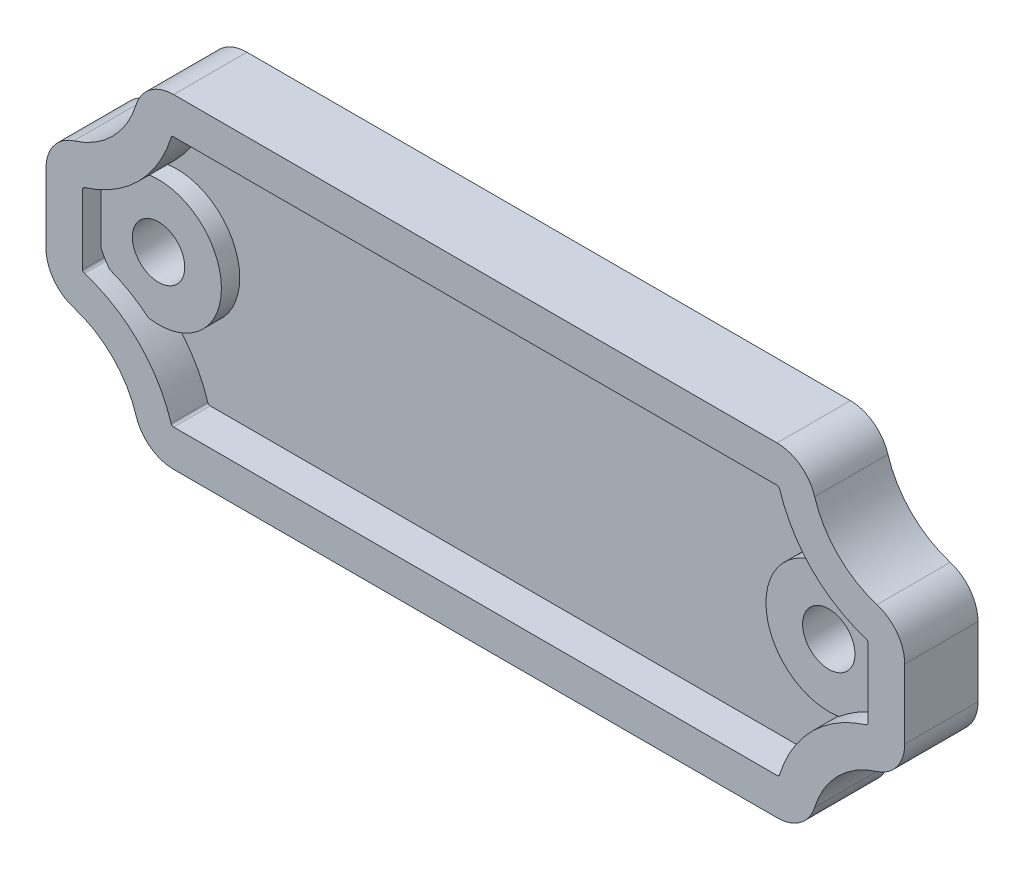
from build123d import *

# Parameters (mm, degrees)
SKETCH1_R           = 2.5
BOSS_EXTRUDE1_DEPTH = 7
FILLET1_R           = 3.75
CUT_EXTRUDE1_DEPTH  = 3.5
BOSS_EXTRUDE2_START = -5.25
SKETCH4_R           = 6
SKETCH4_R_2         = 2.5
BOSS_EXTRUDE2_DEPTH = 7


with BuildPart() as part:
    # Sketch1 → Boss-Extrude1 (new body)
    with BuildSketch(Plane.XY):
        with BuildLine():
            ThreePointArc((-41, -6.5), (-34.636038969, -9.136038969), (-32, -15.5))
            Line((-32, -15.5), (32, -15.5))
            ThreePointArc((32, -15.5), (34.636038969, -9.136038969), (41, -6.5))
            Line((41, -6.5), (41, 6.5))
            ThreePointArc((41, 6.5), (34.636038969, 9.136038969), (32, 15.5))
            Line((32, 15.5), (-32, 15.5))
            ThreePointArc((-32, 15.5), (-34.636038969, 9.136038969), (-41, 6.5))
            Line((-41, 6.5), (-41, -6.5))
        make_face()
        with Locations((-32, 0)):
            Circle(SKETCH1_R, mode=Mode.SUBTRACT)
        with Locations((32, 0)):
            Circle(SKETCH1_R, mode=Mode.SUBTRACT)
    extrude(amount=BOSS_EXTRUDE1_DEPTH)

    # Fillet1
    fillet1_edges = [part.edges().sort_by_distance(p)[0] for p in [
        (32, -15.5, 3.5),
        (-32, -15.5, 3.5),
        (-41, -6.5, 3.5),
        (-41, 6.5, 3.5),
        (-32, 15.5, 3.5),
        (32, 15.5, 3.5),
        (41, 6.5, 3.5),
        (41, -6.5, 3.5),
    ]]
    fillet(fillet1_edges, radius=FILLET1_R)

    # Sketch3 → Cut-Extrude1 (cut)
    with BuildSketch(Plane.XY.offset(7)):
        with BuildLine():
            Line((-28.813942393, -12), (28.813942393, -12))
            ThreePointArc((28.813942393, -12), (28.962464524, -11.951099917), (29.052884699, -11.823529412))
            ThreePointArc((29.052884699, -11.823529412), (32.161165235, -6.661165235), (37.323529412, -3.552884699))
            ThreePointArc((37.323529412, -3.552884699), (37.451099917, -3.462464524), (37.5, -3.313942393))
            Line((37.5, -3.313942393), (37.5, 3.313942393))
            ThreePointArc((37.5, 3.313942393), (37.451099917, 3.462464524), (37.323529412, 3.552884699))
            ThreePointArc((37.323529412, 3.552884699), (32.161165235, 6.661165235), (29.052884699, 11.823529412))
            ThreePointArc((29.052884699, 11.823529412), (28.962464524, 11.951099917), (28.813942393, 12))
            Line((28.813942393, 12), (-28.813942393, 12))
            ThreePointArc((-28.813942393, 12), (-28.962464524, 11.951099917), (-29.052884699, 11.823529412))
            ThreePointArc((-29.052884699, 11.823529412), (-32.161165235, 6.661165235), (-37.323529412, 3.552884699))
            ThreePointArc((-37.323529412, 3.552884699), (-37.451099917, 3.462464524), (-37.5, 3.313942393))
            Line((-37.5, 3.313942393), (-37.5, -3.313942393))
            ThreePointArc((-37.5, -3.313942393), (-37.451099917, -3.462464524), (-37.323529412, -3.552884699))
            ThreePointArc((-37.323529412, -3.552884699), (-32.161165235, -6.661165235), (-29.052884699, -11.823529412))
            ThreePointArc((-29.052884699, -11.823529412), (-28.962464524, -11.951099917), (-28.813942393, -12))
        make_face()
    extrude(amount=-CUT_EXTRUDE1_DEPTH, mode=Mode.SUBTRACT)

    # Sketch4 → Boss-Extrude2 (add)
    # profile 1 of 2: a face of its own
    with BuildSketch(Plane.XY.offset(3.5).offset(BOSS_EXTRUDE2_START)):
        with Locations((-32, 0)):
            Circle(SKETCH4_R)
        with Locations((-32, 0)):
            Circle(SKETCH4_R_2, mode=Mode.SUBTRACT)
    # profile 2 of 2: a face of its own
    with BuildSketch(Plane.XY.offset(3.5).offset(BOSS_EXTRUDE2_START)):
        with Locations((32, 0)):
            Circle(SKETCH4_R)
        with Locations(Location((32, 0, 0), (0, 0, 180))):
            Circle(SKETCH4_R_2, mode=Mode.SUBTRACT)
    extrude(amount=BOSS_EXTRUDE2_DEPTH)


solid = part.part
